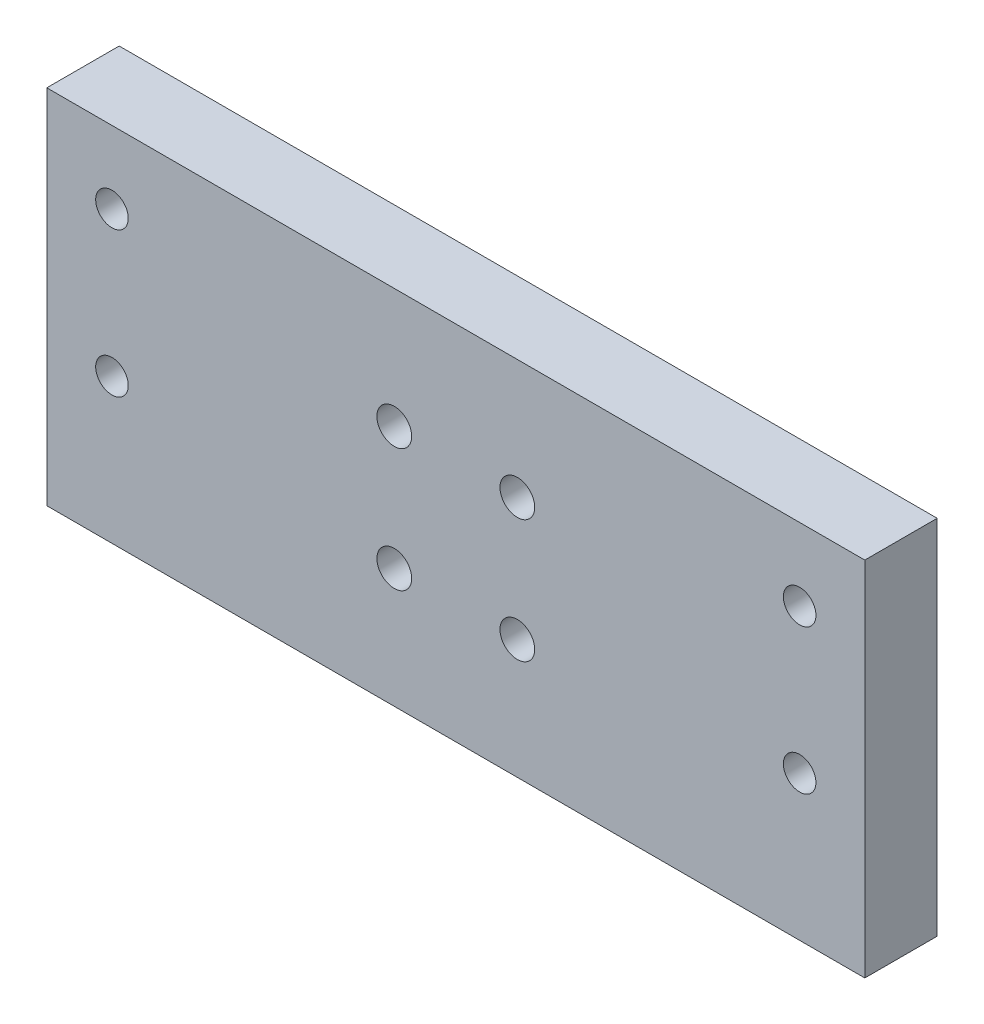
from build123d import *

# Parameters (mm, degrees)
SKETCH1_W                      = 113
SKETCH1_H                      = 50
BOSS_EXTRUDE1_DEPTH            = 10
CBORE_FOR_M4_SHCS1_D           = 4.8
CBORE_FOR_M4_SHCS1_CBORE_D     = 8
CBORE_FOR_M4_SHCS1_CBORE_DEPTH = 4
SKETCH4_R                      = 2.25
CUT_EXTRUDE1_DEPTH             = 63.587938135


with BuildPart() as part:
    # Sketch1 → Boss-Extrude1 (new body)
    with BuildSketch(Plane.XY):
        Rectangle(SKETCH1_W, SKETCH1_H)
    extrude(amount=BOSS_EXTRUDE1_DEPTH)

    # CBORE for M4 SHCS1 (through all)
    with Locations(Plane(origin=(0, 0, 0), x_dir=(-1, 0, 0), z_dir=(0, 0, -1))):
        with Locations((-8.5, 8.5), (-8.5, -8.5), (8.5, -8.5), (8.5, 8.5)):
            CounterBoreHole(CBORE_FOR_M4_SHCS1_D / 2, CBORE_FOR_M4_SHCS1_CBORE_D / 2, CBORE_FOR_M4_SHCS1_CBORE_DEPTH)

    # Sketch4 → Cut-Extrude1 (cut, through all)
    with BuildSketch(Plane(origin=(0, 0, 0), x_dir=(-1, 0, 0), z_dir=(0, 0, -1))):
        with Locations((-47.5, 15)):
            Circle(SKETCH4_R)
        with Locations((-47.5, -5)):
            Circle(SKETCH4_R)
        with Locations(Location((47.5, -5, 0), (0, 0, 180))):
            Circle(SKETCH4_R)
        with Locations(Location((47.5, 15, 0), (0, 0, 180))):
            Circle(SKETCH4_R)
    extrude(amount=-CUT_EXTRUDE1_DEPTH, mode=Mode.SUBTRACT)


solid = part.part
